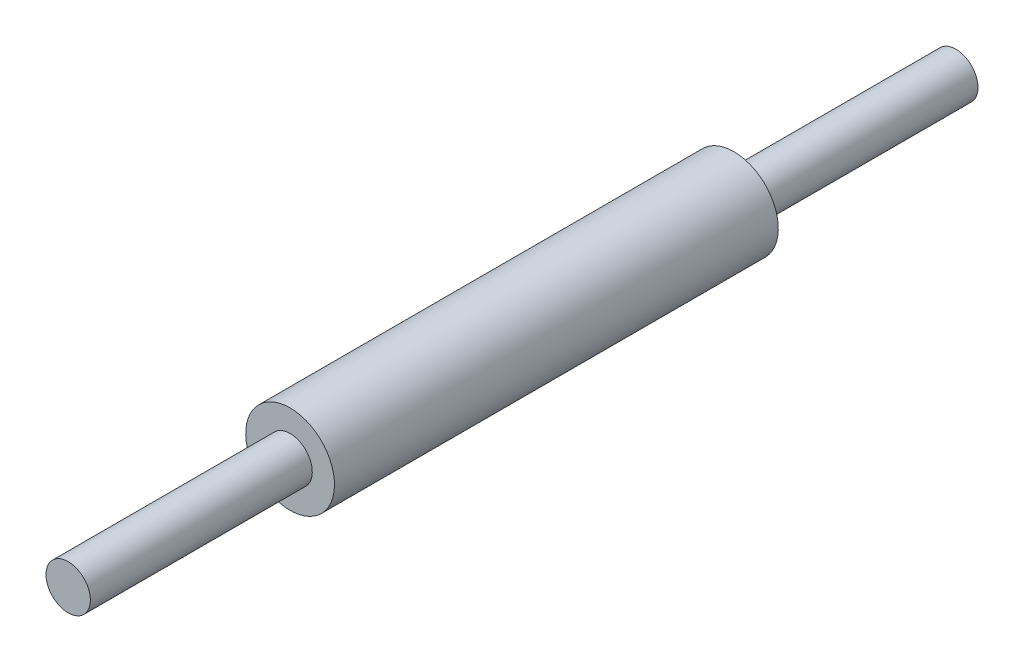
from build123d import *


with BuildPart() as part:
    # Sketch3 → Revolve1 (revolve)
    with BuildSketch(Plane(origin=(0, 0, 0), x_dir=(0, 0, -1), z_dir=(1, 0, 0))):
        Polygon((0, 0), (0, 3.175), (31.75, 3.175), (31.75, 6.35), (95.25, 6.35), (95.25, 3.175), (127, 3.175), (127, 0), align=None)
    revolve(axis=Axis((0, 0, -127), (0, 0, 1)))


solid = part.part
